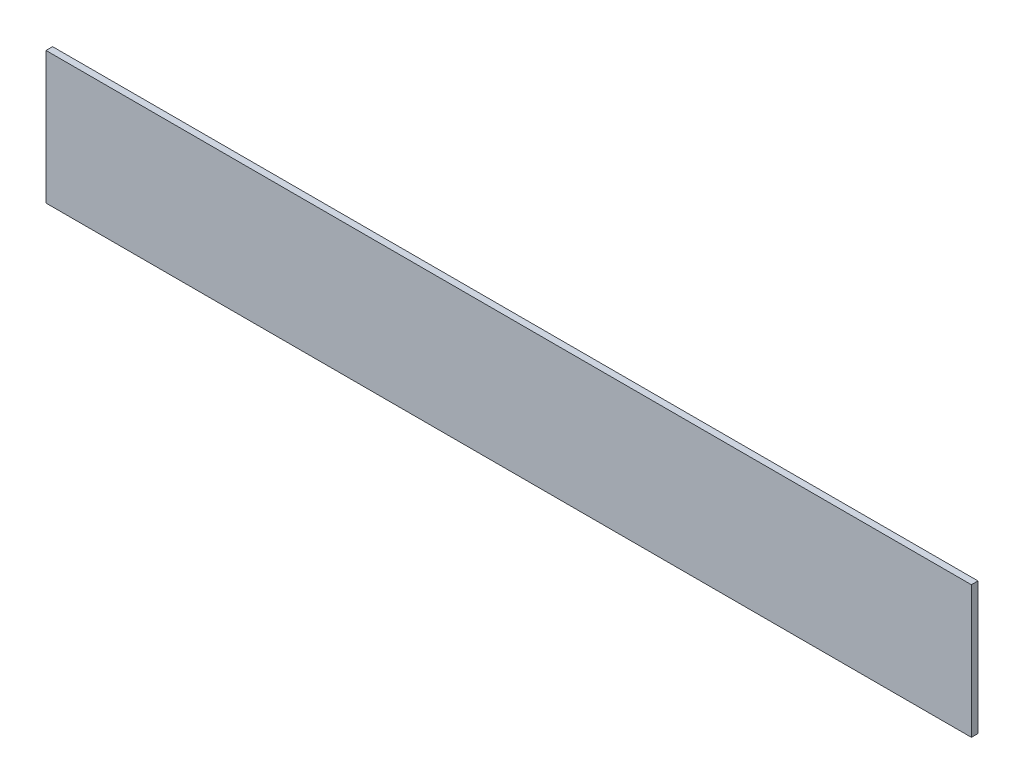
from build123d import *

# Parameters (mm, degrees)
OVEN_KESME_BICAK_1_2X28_T1_2_1_START = -299
SKETCH1_W                            = 280
SKETCH1_H                            = 40
OVEN_KESME_BICAK_1_2X28_T1_2_1_DEPTH = 2


with BuildPart() as part:
    # Sketch1 → OVEN_kesme_bicak_1_2x28_t1.2_1 (new body)
    with BuildSketch(Plane.XY.offset(OVEN_KESME_BICAK_1_2X28_T1_2_1_START)):
        with Locations((350, 380)):
            Rectangle(SKETCH1_W, SKETCH1_H)
    extrude(amount=-OVEN_KESME_BICAK_1_2X28_T1_2_1_DEPTH)


solid = part.part
